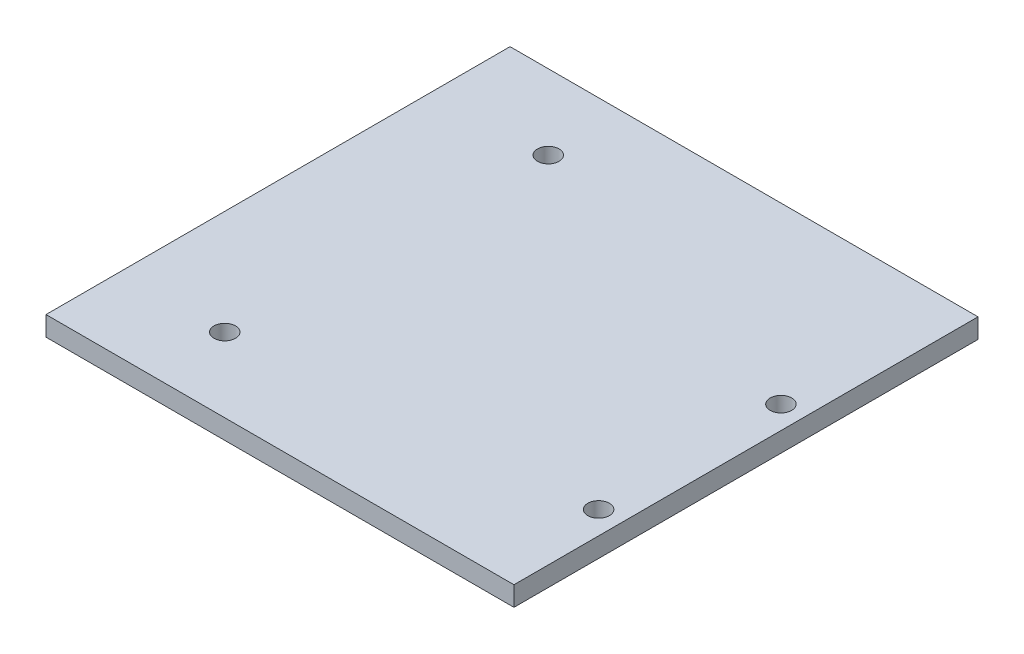
from build123d import *

# Parameters (mm, degrees)
SKETCH1_W           = 71.6
SKETCH1_H           = 71
BOSS_EXTRUDE1_DEPTH = 3
SKETCH2_R           = 1.65
CUT_EXTRUDE1_DEPTH  = 3


with BuildPart() as part:
    # Sketch1 → Boss-Extrude1 (new body)
    with BuildSketch(Plane(origin=(0, 0, 0), x_dir=(1, 0, 0), z_dir=(0, 1, 0))):
        with Locations((37.662492514, -4.083221758)):
            Rectangle(SKETCH1_W, SKETCH1_H)
    extrude(amount=BOSS_EXTRUDE1_DEPTH)

    # Sketch2 → Cut-Extrude1 (cut)
    with BuildSketch(Plane(origin=(0, 3, 0), x_dir=(1, 0, 0), z_dir=(0, 1, 0))):
        with Locations(Location((19.162492514, 19.966778242, 0), (0, 0, 270))):
            Circle(SKETCH2_R)
        with Locations(Location((17.862492514, -28.233221758, 0), (0, 0, 270))):
            Circle(SKETCH2_R)
        with Locations(Location((69.962492514, 4.766778242, 0), (0, 0, 270))):
            Circle(SKETCH2_R)
        with Locations(Location((69.962492514, -23.133221758, 0), (0, 0, 270))):
            Circle(SKETCH2_R)
    extrude(amount=-CUT_EXTRUDE1_DEPTH, mode=Mode.SUBTRACT)


solid = part.part
